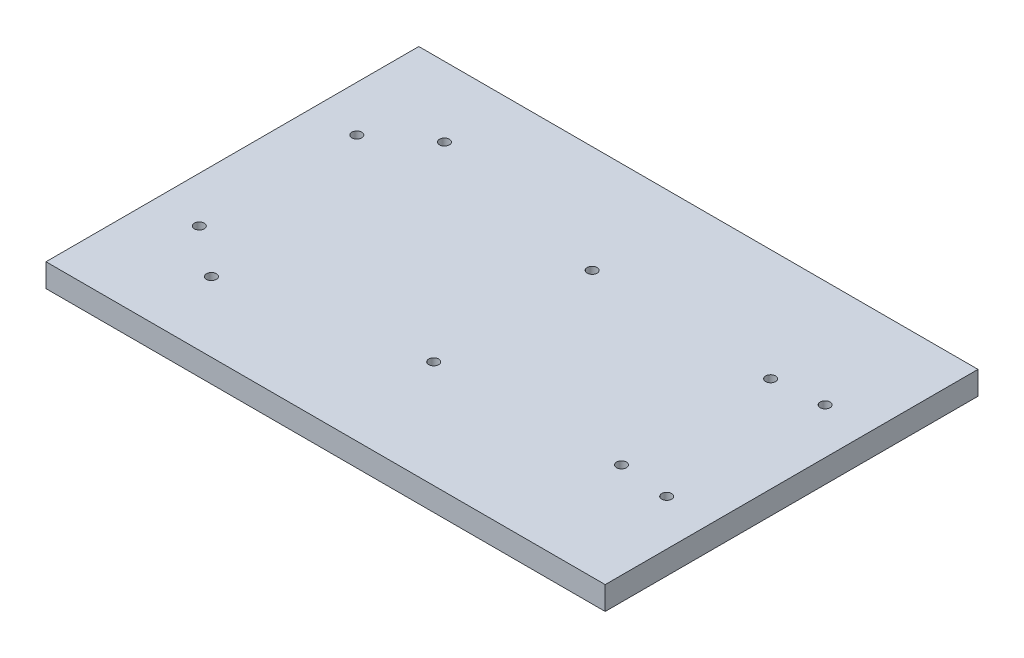
from build123d import *

# Parameters (mm, degrees)
SKETCH1_W                 = 152.4
SKETCH1_H                 = 101.6
SKETCH1_W_2               = 127.508
SKETCH1_H_2               = 42.926
SKETCH1_W_3               = 64.008
SKETCH1_W_4               = 63.5
BOSS_EXTRUDE1_DEPTH       = 6.35
TAP_DRILL_FOR_6_32_TAP2_D = 2.7051
TAP_DRILL_FOR_6_32_TAP5_D = 2.7051


with BuildPart() as part:
    # Sketch1 → Boss-Extrude1 (new body)
    # profile 1 of 3: a face of its own
    with BuildSketch(Plane(origin=(0, 0, 0), x_dir=(1, 0, 0), z_dir=(0, 1, 0))):
        Rectangle(SKETCH1_W, SKETCH1_H)
        Rectangle(SKETCH1_W_2, SKETCH1_H_2, mode=Mode.SUBTRACT)
    # profile 2 of 3: a face of its own
    with BuildSketch(Plane(origin=(0, 0, 0), x_dir=(1, 0, 0), z_dir=(0, 1, 0))):
        with Locations((-31.75, 0)):
            Rectangle(SKETCH1_W_3, SKETCH1_H_2)
    # profile 3 of 3: a face of its own
    with BuildSketch(Plane(origin=(0, 0, 0), x_dir=(1, 0, 0), z_dir=(0, 1, 0))):
        with Locations((32.004, 0)):
            Rectangle(SKETCH1_W_4, SKETCH1_H_2)
    extrude(amount=-BOSS_EXTRUDE1_DEPTH)

    # Tap Drill for #6-32 Tap2 (through all)
    with Locations(Plane(origin=(-63.753873504, 0, -21.463), x_dir=(0, 0, 1), z_dir=(0, 1, 0))):
        with Locations((0, 0), (-0.1272545, 64.007873503), (-0.127, 127.507873502), (43.053, 127.507873502), (43.0527455, 64.007873503), (42.926, 0)):
            Hole(TAP_DRILL_FOR_6_32_TAP2_D / 2)

    # Tap Drill for #6-32 Tap5 (through all)
    with Locations(Plane(origin=(-50.165, 0, -31.75), x_dir=(0, 0, 1), z_dir=(0, 1, 0))):
        with Locations((0, 0), (63.5, 0), (52.07, 100.33), (11.43, 100.33)):
            Hole(TAP_DRILL_FOR_6_32_TAP5_D / 2)


solid = part.part
